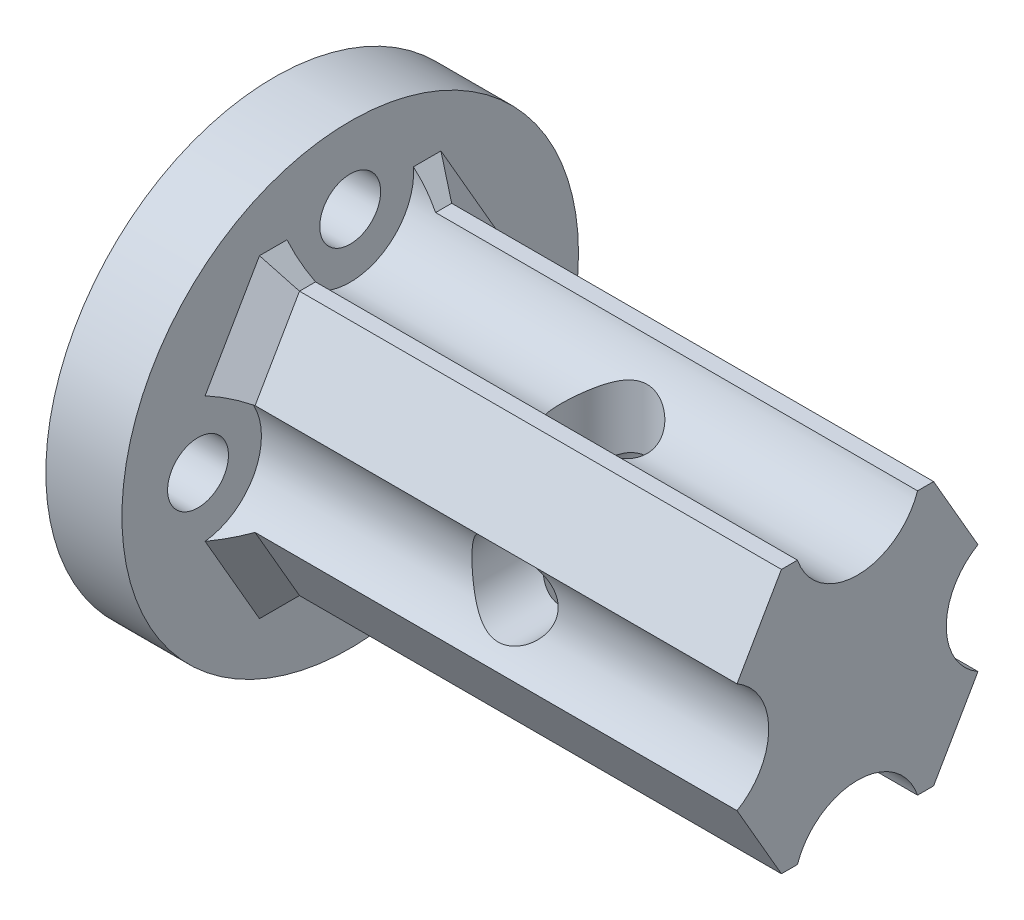
from build123d import *

# Parameters (mm, degrees)
SKETCH1_R           = 9
SKETCH1_R_2         = 1.2
BOSS_EXTRUDE1_DEPTH = 3
BOSS_EXTRUDE2_DEPTH = 20
CHAMFER1_SIZE       = 1
SKETCH4_R           = 1.7
CUT_EXTRUDE1_DEPTH  = 29.487378672
SKETCH5_R           = 1.7
CUT_EXTRUDE2_DEPTH  = 29.896366633


with BuildPart() as part:
    # Sketch1 → Boss-Extrude1 (new body)
    with BuildSketch(Plane(origin=(0, 0, 0), x_dir=(0, 0, -1), z_dir=(1, 0, 0))):
        Circle(SKETCH1_R)
        with Locations((0, 6)):
            Circle(SKETCH1_R_2, mode=Mode.SUBTRACT)
        with Locations((6, 0)):
            Circle(SKETCH1_R_2, mode=Mode.SUBTRACT)
        with Locations((-6, 0)):
            Circle(SKETCH1_R_2, mode=Mode.SUBTRACT)
        with Locations((0, -6)):
            Circle(SKETCH1_R_2, mode=Mode.SUBTRACT)
    extrude(amount=BOSS_EXTRUDE1_DEPTH)

    # Sketch2 → Boss-Extrude2 (add)
    with BuildSketch(Plane(origin=(3, 0, 0), x_dir=(0, 0, -1), z_dir=(1, 0, 0))):
        with BuildLine():
            Line((2.367240814, -5.196152423), (3, -5.196152423))
            Line((3, -5.196152423), (4.75, -2.165063509))
            ThreePointArc((4.75, -2.165063509), (3.5, 0), (4.75, 2.165063509))
            Line((4.75, 2.165063509), (3, 5.196152423))
            Line((3, 5.196152423), (2.367240814, 5.196152423))
            ThreePointArc((2.367240814, 5.196152423), (0, 3.5), (-2.367240814, 5.196152423))
            Line((-2.367240814, 5.196152423), (-3, 5.196152423))
            Line((-3, 5.196152423), (-4.75, 2.165063509))
            ThreePointArc((-4.75, 2.165063509), (-3.5, 0), (-4.75, -2.165063509))
            Line((-4.75, -2.165063509), (-3, -5.196152423))
            Line((-3, -5.196152423), (-2.367240814, -5.196152423))
            ThreePointArc((-2.367240814, -5.196152423), (0, -3.5), (2.367240814, -5.196152423))
        make_face()
    extrude(amount=BOSS_EXTRUDE2_DEPTH)

    # Chamfer1
    chamfer1_edges = [part.edges().sort_by_distance(p)[0] for p in [
        (3, -3.680607966, 3.875),
        (3, -5.196152423, 2.683620407),
        (3, -5.196152423, -2.683620407),
        (3, -3.680607966, -3.875),
        (3, 3.680607966, -3.875),
        (3, 5.196152423, -2.683620407),
        (3, 3.680607966, 3.875),
        (3, 5.196152423, 2.683620407),
    ]]
    chamfer(chamfer1_edges, length=CHAMFER1_SIZE)

    # Sketch4 → Cut-Extrude1 (cut, through all)
    with BuildSketch(Plane.XZ.offset(5.196152423)):
        with Locations((13, 0)):
            Circle(SKETCH4_R)
    extrude(amount=-CUT_EXTRUDE1_DEPTH, mode=Mode.SUBTRACT)

    # Sketch5 → Cut-Extrude2 (cut, through all)
    with BuildSketch(Plane.XY.offset(6)):
        with Locations((13, 0)):
            Circle(SKETCH5_R)
    extrude(amount=-CUT_EXTRUDE2_DEPTH, mode=Mode.SUBTRACT)


solid = part.part
